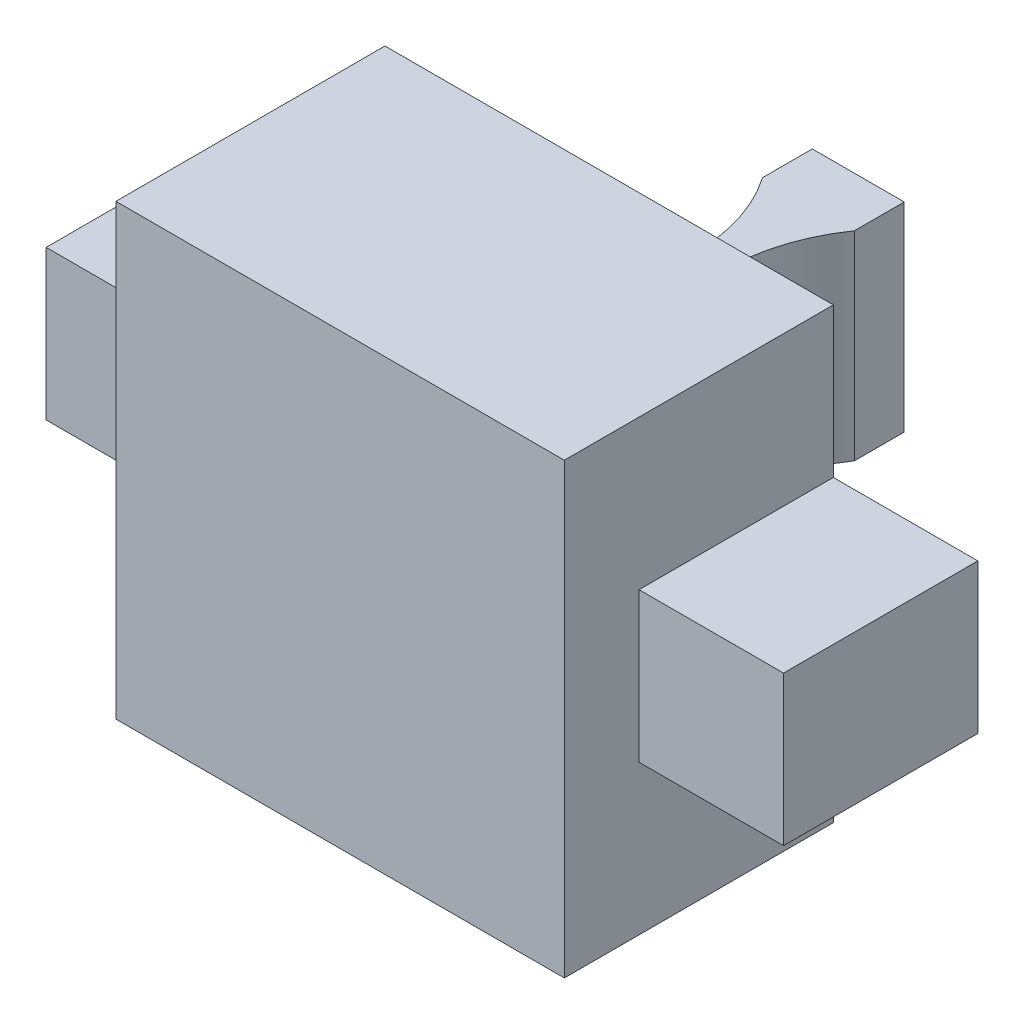
from build123d import *

# Parameters (mm, degrees)
SKETCH_1_W      = 9
SKETCH_1_H      = 9
EXTRUDE_1_DEPTH = 5.4
SKETCH_2_W      = 2.9
SKETCH_2_H      = 3
EXTRUDE_2_DEPTH = 3.9
EXTRUDE_3_DEPTH = 2


with BuildPart() as part:
    # 스케치1 → 보스-돌출1 (new body)
    with BuildSketch(Plane.XY):
        with Locations((4.5, 4.5)):
            Rectangle(SKETCH_1_W, SKETCH_1_H)
    extrude(amount=EXTRUDE_1_DEPTH)

    # 스케치2 → 보스-돌출2 (add)
    with BuildSketch(Plane(origin=(0, 0, 0), x_dir=(-1, 0, 0), z_dir=(0, 0, -1))):
        with Locations((1.45, 4.5)):
            Rectangle(SKETCH_2_W, SKETCH_2_H)
        with Locations((-10.45, 4.5)):
            Rectangle(SKETCH_2_W, SKETCH_2_H)
    extrude(amount=-EXTRUDE_2_DEPTH)

    # 스케치3 → 보스-돌출3 (add, symmetric)
    with BuildSketch(Plane(origin=(0, 4.5, 0), x_dir=(1, 0, 0), z_dir=(0, 1, 0))):
        with BuildLine():
            Line((3.577763231, 4), (3.577763231, 5))
            Line((3.577763231, 5), (5.422236769, 5))
            Line((5.422236769, 5), (5.422236769, 4))
            ThreePointArc((5.422236769, 4), (4.794518093, 2), (5.422236769, 0))
            Line((5.422236769, 0), (3.577763231, 0))
            ThreePointArc((3.577763231, 0), (4.205481907, 2), (3.577763231, 4))
        make_face()
    extrude(amount=EXTRUDE_3_DEPTH, both=True)


solid = part.part
